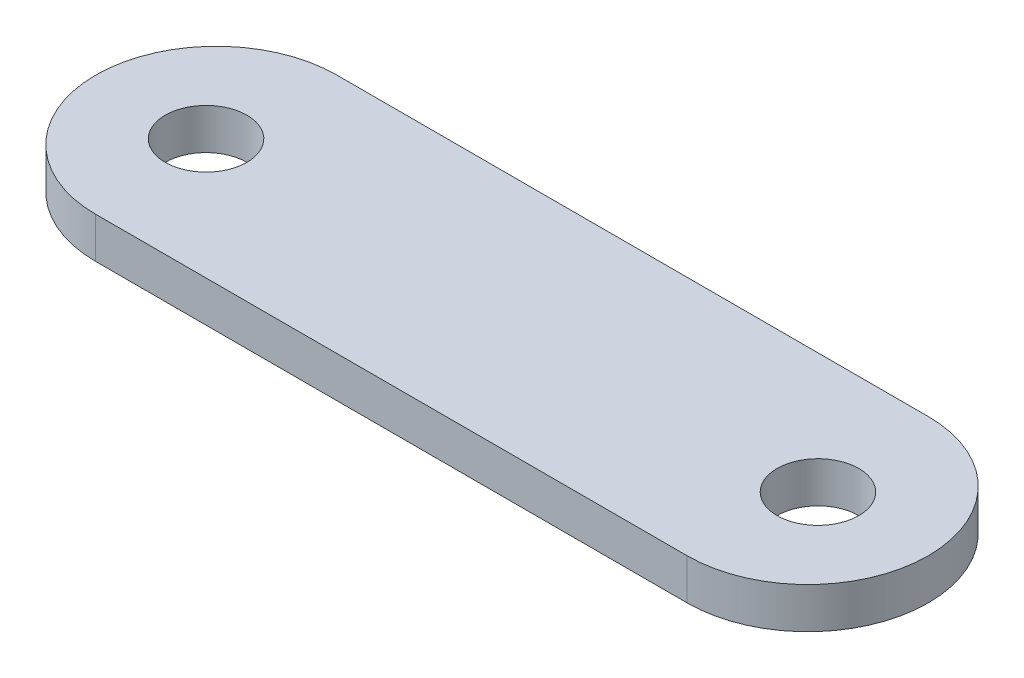
from build123d import *

# Parameters (mm, degrees)
BOSS_EXTRUDE1_DEPTH = 2
SKETCH5_R           = 2
CUT_EXTRUDE1_DEPTH  = 76.301439031
SKETCH6_W           = 2
SKETCH6_H           = 2
BOSS_EXTRUDE2_DEPTH = 2


with BuildPart() as part:
    # Sketch4 → Boss-Extrude1 (new body)
    with BuildSketch(Plane(origin=(0, 0, 0), x_dir=(1, 0, 0), z_dir=(0, 1, 0))):
        with BuildLine():
            Line((-69.143298969, 5.9), (-40.200862119, 5.9))
            ThreePointArc((-40.200862119, 5.9), (-34.300862119, 0), (-40.200862119, -5.9))
            Line((-40.200862119, -5.9), (-69.143298969, -5.9))
            ThreePointArc((-69.143298969, -5.9), (-75.043298969, 0), (-69.143298969, 5.9))
        make_face()
    extrude(amount=BOSS_EXTRUDE1_DEPTH)

    # Sketch5 → Cut-Extrude1 (cut, through all)
    with BuildSketch(Plane.XZ):
        with Locations(Location((-39.700862119, 0, 0), (0, 0, 270))):
            Circle(SKETCH5_R)
        with Locations(Location((-69.643298969, 0, 0), (0, 0, 270))):
            Circle(SKETCH5_R)
    extrude(amount=-CUT_EXTRUDE1_DEPTH, mode=Mode.SUBTRACT)

    # Sketch6 → Boss-Extrude2 (add)
    with BuildSketch(Plane.XZ):
        with Locations((-66.143298969, 0)):
            Rectangle(SKETCH6_W, SKETCH6_H)
    extrude(amount=BOSS_EXTRUDE2_DEPTH)


solid = part.part
